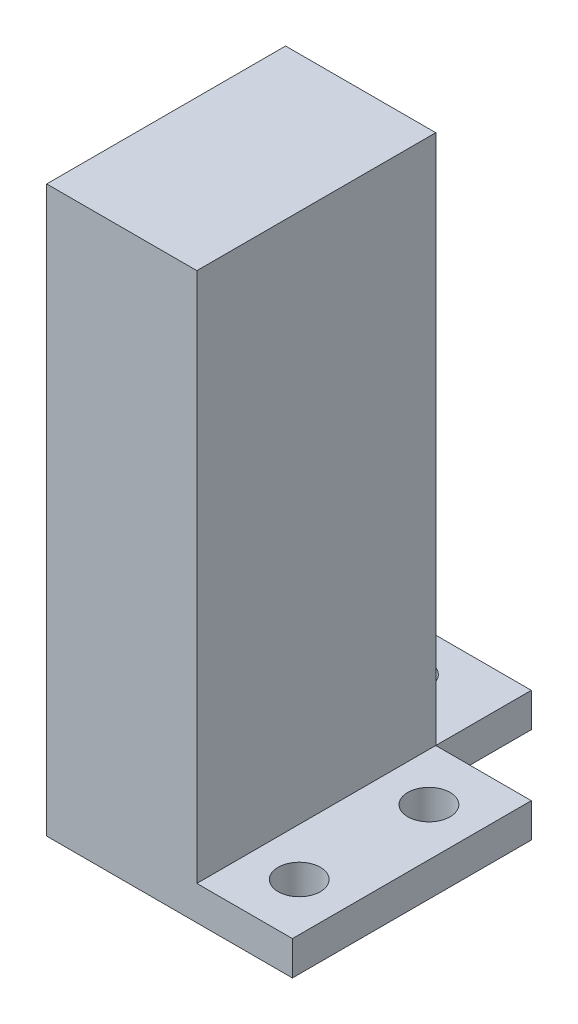
from build123d import *

# Parameters (mm, degrees)
SKETCH1_W           = 22
SKETCH1_H           = 82.75
SKETCH1_R           = 3.1
BOSS_EXTRUDE1_DEPTH = 30
SKETCH2_W           = 22
SKETCH2_H           = 82.75
BOSS_EXTRUDE2_DEPTH = 5
SKETCH3_W           = 22
SKETCH3_H           = 14
SKETCH3_R           = 3.1
SKETCH3_W_2         = 14
SKETCH3_H_2         = 35
BOSS_EXTRUDE3_DEPTH = 5
BOSS_EXTRUDE5_START = 15
SKETCH5_R           = 3.1
BOSS_EXTRUDE5_DEPTH = 15


with BuildPart() as part:
    # Sketch1 → Boss-Extrude1 (new body)
    with BuildSketch(Plane.XY):
        with Locations((0, 7.844654309)):
            Rectangle(SKETCH1_W, SKETCH1_H)
        with Locations((0, 35.719654309)):
            Circle(SKETCH1_R, mode=Mode.SUBTRACT)
        with Locations((0, 7.719654309)):
            Circle(SKETCH1_R, mode=Mode.SUBTRACT)
    extrude(amount=BOSS_EXTRUDE1_DEPTH)

    # Sketch2 → Boss-Extrude2 (add)
    with BuildSketch(Plane.XY.offset(30)):
        with Locations((0, 7.844654309)):
            Rectangle(SKETCH2_W, SKETCH2_H)
    extrude(amount=BOSS_EXTRUDE2_DEPTH)

    # Sketch3 → Boss-Extrude3 (add)
    # profile 1 of 2: a face of its own
    with BuildSketch(Plane.XZ.offset(33.530345691)):
        with Locations((0, -7)):
            Rectangle(SKETCH3_W, SKETCH3_H)
        with Locations(Location((0, -7, 0), (0, 0, 270))):
            Circle(SKETCH3_R, mode=Mode.SUBTRACT)
    # profile 2 of 2: a face of its own
    with BuildSketch(Plane.XZ.offset(33.530345691)):
        with Locations((18, 17.5)):
            Rectangle(SKETCH3_W_2, SKETCH3_H_2)
        with Locations(Location((18, 27, 0), (0, 0, 270))):
            Circle(SKETCH3_R, mode=Mode.SUBTRACT)
        with Locations(Location((18, 8, 0), (0, 0, 270))):
            Circle(SKETCH3_R, mode=Mode.SUBTRACT)
    extrude(amount=-BOSS_EXTRUDE3_DEPTH)

    # Sketch5 → Boss-Extrude5 (add)
    with BuildSketch(Plane(origin=(0, 0, 30), x_dir=(-1, 0, 0), z_dir=(0, 0, -1)).offset(BOSS_EXTRUDE5_START)):
        with Locations((0, 7.719654309)):
            Circle(SKETCH5_R)
        with Locations((0, 35.719654309)):
            Circle(SKETCH5_R)
    extrude(amount=-BOSS_EXTRUDE5_DEPTH)


solid = part.part
